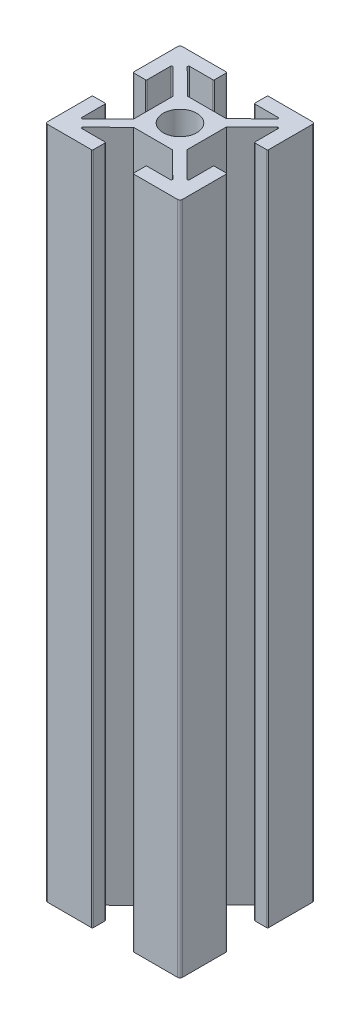
from build123d import *

# Parameters (mm, degrees)
SKETCH1_R           = 2.5
BOSS_EXTRUDE1_DEPTH = 100


with BuildPart() as part:
    # Sketch1 → Boss-Extrude1 (new body)
    with BuildSketch(Plane(origin=(0, 0, 0), x_dir=(1, 0, 0), z_dir=(0, 1, 0))):
        with BuildLine():
            Line((-5.357713917, -5.679481981), (-3.657713917, -5.679481981))
            ThreePointArc((-3.657713917, -5.679481981), (-3.5516479, -5.635547998), (-3.507713917, -5.529481981))
            Line((-3.507713917, -5.529481981), (-3.507713917, -2.093297468))
            ThreePointArc((-3.507713917, -2.093297468), (-3.415514871, -1.954881249), (-3.252259921, -1.98662294))
            Line((-3.252259921, -1.98662294), (0.53858238, -5.734091759))
            Line((0.53858238, -5.734091759), (0.53858238, -11.624872203))
            Line((0.53858238, -11.624872203), (-3.252259921, -15.372341022))
            ThreePointArc((-3.252259921, -15.372341022), (-3.415514871, -15.404082713), (-3.507713917, -15.265666494))
            Line((-3.507713917, -15.265666494), (-3.507713917, -11.829481981))
            ThreePointArc((-3.507713917, -11.829481981), (-3.5516479, -11.723415964), (-3.657713917, -11.679481981))
            Line((-3.657713917, -11.679481981), (-5.357713917, -11.679481981))
            ThreePointArc((-5.357713917, -11.679481981), (-5.463779934, -11.723415964), (-5.507713917, -11.829481981))
            Line((-5.507713917, -11.829481981), (-5.507713917, -18.329481981))
            ThreePointArc((-5.507713917, -18.329481981), (-5.40520129, -18.576969354), (-5.157713917, -18.679481981))
            Line((-5.157713917, -18.679481981), (1.342286083, -18.679481981))
            ThreePointArc((1.342286083, -18.679481981), (1.4483521, -18.635547998), (1.492286083, -18.529481981))
            Line((1.492286083, -18.529481981), (1.492286083, -16.829481981))
            ThreePointArc((1.492286083, -16.829481981), (1.4483521, -16.723415964), (1.342286083, -16.679481981))
            Line((1.342286083, -16.679481981), (-2.075798714, -16.679481981))
            ThreePointArc((-2.075798714, -16.679481981), (-2.214545208, -16.586485581), (-2.181252709, -16.422807453))
            Line((-2.181252709, -16.422807453), (1.605398289, -12.679481981))
            Line((1.605398289, -12.679481981), (7.379173877, -12.679481981))
            Line((7.379173877, -12.679481981), (11.165824876, -16.422807453))
            ThreePointArc((11.165824876, -16.422807453), (11.199117374, -16.586485581), (11.06037088, -16.679481981))
            Line((11.06037088, -16.679481981), (7.642286083, -16.679481981))
            ThreePointArc((7.642286083, -16.679481981), (7.536220066, -16.723415964), (7.492286083, -16.829481981))
            Line((7.492286083, -16.829481981), (7.492286083, -18.529481981))
            ThreePointArc((7.492286083, -18.529481981), (7.536220066, -18.635547998), (7.642286083, -18.679481981))
            Line((7.642286083, -18.679481981), (14.142286083, -18.679481981))
            ThreePointArc((14.142286083, -18.679481981), (14.389773457, -18.576969354), (14.492286083, -18.329481981))
            Line((14.492286083, -18.329481981), (14.492286083, -11.829481981))
            ThreePointArc((14.492286083, -11.829481981), (14.4483521, -11.723415964), (14.342286083, -11.679481981))
            Line((14.342286083, -11.679481981), (12.642286083, -11.679481981))
            ThreePointArc((12.642286083, -11.679481981), (12.536220066, -11.723415964), (12.492286083, -11.829481981))
            Line((12.492286083, -11.829481981), (12.492286083, -15.265666494))
            ThreePointArc((12.492286083, -15.265666494), (12.400087038, -15.404082713), (12.236832088, -15.372341022))
            Line((12.236832088, -15.372341022), (8.445989787, -11.624872203))
            Line((8.445989787, -11.624872203), (8.445989787, -5.734091759))
            Line((8.445989787, -5.734091759), (12.236832088, -1.98662294))
            ThreePointArc((12.236832088, -1.98662294), (12.400087038, -1.954881249), (12.492286083, -2.093297468))
            Line((12.492286083, -2.093297468), (12.492286083, -5.529481981))
            ThreePointArc((12.492286083, -5.529481981), (12.536220066, -5.635547998), (12.642286083, -5.679481981))
            Line((12.642286083, -5.679481981), (14.342286083, -5.679481981))
            ThreePointArc((14.342286083, -5.679481981), (14.4483521, -5.635547998), (14.492286083, -5.529481981))
            Line((14.492286083, -5.529481981), (14.492286083, 0.970518019))
            ThreePointArc((14.492286083, 0.970518019), (14.389773457, 1.218005392), (14.142286083, 1.320518019))
            Line((14.142286083, 1.320518019), (7.642286083, 1.320518019))
            ThreePointArc((7.642286083, 1.320518019), (7.536220066, 1.276584036), (7.492286083, 1.170518019))
            Line((7.492286083, 1.170518019), (7.492286083, -0.529481981))
            ThreePointArc((7.492286083, -0.529481981), (7.536220066, -0.635547998), (7.642286083, -0.679481981))
            Line((7.642286083, -0.679481981), (11.06037088, -0.679481981))
            ThreePointArc((11.06037088, -0.679481981), (11.199117374, -0.772478381), (11.165824876, -0.936156509))
            Line((11.165824876, -0.936156509), (7.379173877, -4.679481981))
            Line((7.379173877, -4.679481981), (1.605398289, -4.679481981))
            Line((1.605398289, -4.679481981), (-2.181252709, -0.936156509))
            ThreePointArc((-2.181252709, -0.936156509), (-2.214545208, -0.772478381), (-2.075798714, -0.679481981))
            Line((-2.075798714, -0.679481981), (1.342286083, -0.679481981))
            ThreePointArc((1.342286083, -0.679481981), (1.4483521, -0.635547998), (1.492286083, -0.529481981))
            Line((1.492286083, -0.529481981), (1.492286083, 1.170518019))
            ThreePointArc((1.492286083, 1.170518019), (1.4483521, 1.276584036), (1.342286083, 1.320518019))
            Line((1.342286083, 1.320518019), (-5.157713917, 1.320518019))
            ThreePointArc((-5.157713917, 1.320518019), (-5.40520129, 1.218005392), (-5.507713917, 0.970518019))
            Line((-5.507713917, 0.970518019), (-5.507713917, -5.529481981))
            ThreePointArc((-5.507713917, -5.529481981), (-5.463779934, -5.635547998), (-5.357713917, -5.679481981))
        make_face()
        with Locations(Location((4.492286083, -8.679481981, 0), (0, 0, 270))):
            Circle(SKETCH1_R, mode=Mode.SUBTRACT)
    extrude(amount=BOSS_EXTRUDE1_DEPTH)


solid = part.part
